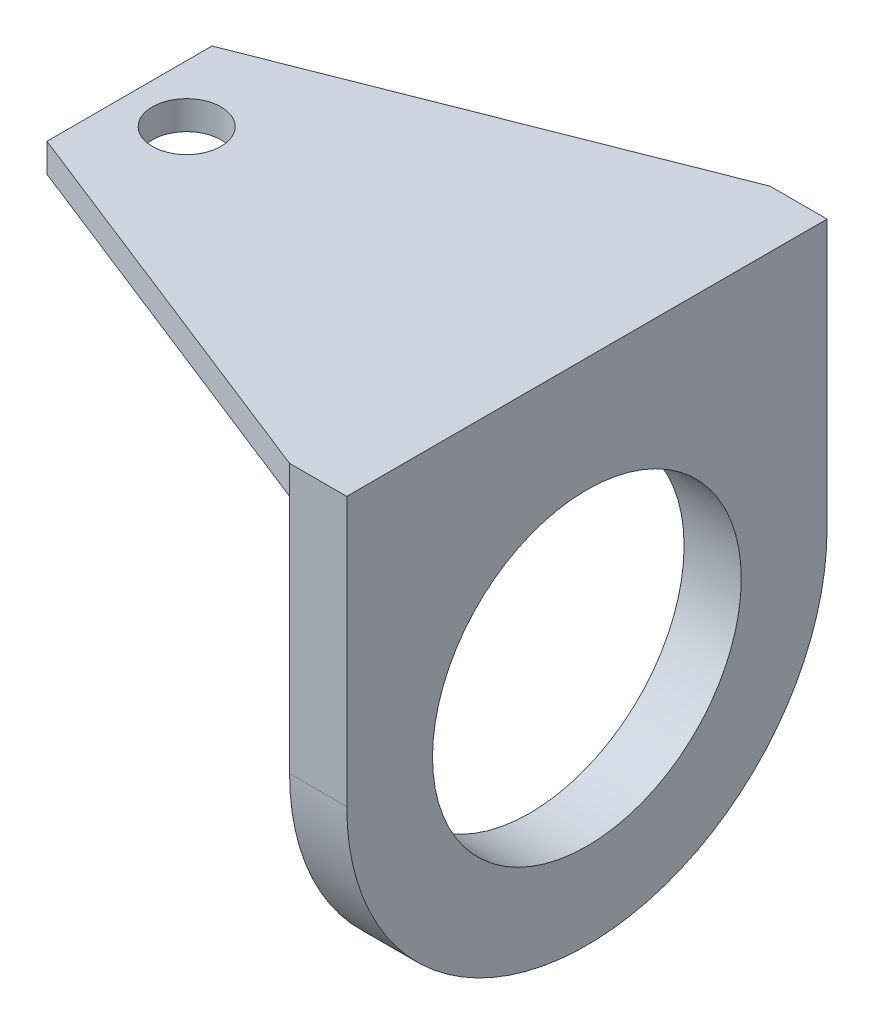
from build123d import *

# Parameters (mm, degrees)
SKETCH1_R                = 21
SKETCH1_R_2              = 13.5
BOSS_EXTRUDE1_DEPTH      = 5
BOSS_EXTRUDE2_REACH      = 49.223
BOSS_EXTRUDE2_END_RADIUS = 21
SKETCH2_W                = 5
SKETCH2_H                = 42
SKETCH2_3_W              = 40
SKETCH2_3_H              = 42
SKETCH2_3_R              = 3
BOSS_EXTRUDE3_DEPTH      = 2.5
CUT_EXTRUDE4_DEPTH       = 59.566201857


with BuildPart() as part:
    # Sketch1 → Boss-Extrude1 (new body)
    with BuildSketch(Plane(origin=(0, 0, 0), x_dir=(0, 0, -1), z_dir=(1, 0, 0))):
        Circle(SKETCH1_R)
        Circle(SKETCH1_R_2, mode=Mode.SUBTRACT)
    extrude(amount=BOSS_EXTRUDE1_DEPTH)

    # Boss-Extrude2: up to this cylinder (the profile starts outside it)
    boss_extrude2_end = Plane(origin=(2.5, 0, 0), z_dir=(-1, 0, 0)) * Cylinder(BOSS_EXTRUDE2_END_RADIUS, 141.446, mode=Mode.PRIVATE)
    # Sketch2 → Boss-Extrude2 (add, up to the surface)
    with BuildSketch(Plane(origin=(0, 21, 0), x_dir=(1, 0, 0), z_dir=(0, 1, 0)), mode=Mode.PRIVATE) as boss_extrude2_sk1:
        with Locations((2.5, 0)):
            Rectangle(SKETCH2_W, SKETCH2_H)
    boss_extrude2_tool1 = extrude(boss_extrude2_sk1.sketch, amount=-BOSS_EXTRUDE2_REACH, mode=Mode.PRIVATE) - boss_extrude2_end
    add(boss_extrude2_tool1.solids().sort_by_distance((2.5, 21, 0))[0])
    add(boss_extrude2_tool1.solids().sort_by_distance((2.5, 21, 0))[1])

    # Sketch2<3> → Boss-Extrude3 (add)
    with BuildSketch(Plane(origin=(0, 21, 0), x_dir=(1, 0, 0), z_dir=(0, 1, 0))):
        with Locations((-15, 0)):
            Rectangle(SKETCH2_3_W, SKETCH2_3_H)
        with Locations((-30, 0)):
            Circle(SKETCH2_3_R, mode=Mode.SUBTRACT)
    extrude(amount=BOSS_EXTRUDE3_DEPTH)

    # Sketch3 → Cut-Extrude4 (cut, through all)
    with BuildSketch(Plane.XZ.offset(-21)):
        Polygon((0, -21), (-35, -7.216009452), (-35, 7.216009452), (0, 21), (0, 27.25128432), (-40.763754419, 27.25128432), (-40.763754419, -28.471778575), (0, -28.471778575), align=None)
    extrude(amount=-CUT_EXTRUDE4_DEPTH, mode=Mode.SUBTRACT)


solid = part.part
